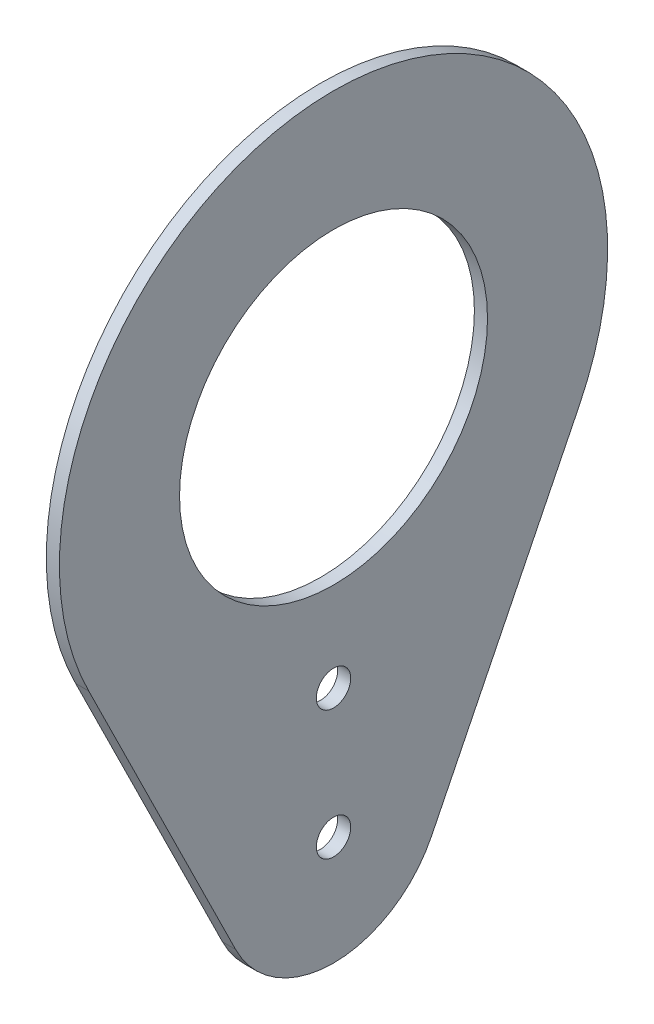
from build123d import *

# Parameters (mm, degrees)
SKETCH3_R           = 17.907
SKETCH3_R_2         = 2
BOSS_EXTRUDE2_DEPTH = 1.524


with BuildPart() as part:
    # Sketch3 → Boss-Extrude2 (new body)
    with BuildSketch(Plane(origin=(0, 0, 0), x_dir=(0, 0, -1), z_dir=(1, 0, 0))):
        with BuildLine():
            Line((28.576291406, -14.121381766), (11.385535187, -48.906685393))
            ThreePointArc((11.385535187, -48.906685393), (-0.000161764, -55.979999999), (-11.385678521, -48.906395349))
            Line((-11.385678521, -48.906395349), (-28.464196302, -14.345988372))
            ThreePointArc((-28.464196302, -14.345988372), (-0.12551239, 31.874787844), (28.576291406, -14.121381766))
        make_face()
        with Locations(Location((0, 0, 0), (0, 0, 180))):
            Circle(SKETCH3_R, mode=Mode.SUBTRACT)
        with Locations(Location((0, -28.28, 0), (0, 0, 180))):
            Circle(SKETCH3_R_2, mode=Mode.SUBTRACT)
        with Locations(Location((0, -43.28, 0), (0, 0, 180))):
            Circle(SKETCH3_R_2, mode=Mode.SUBTRACT)
    extrude(amount=BOSS_EXTRUDE2_DEPTH)


solid = part.part
